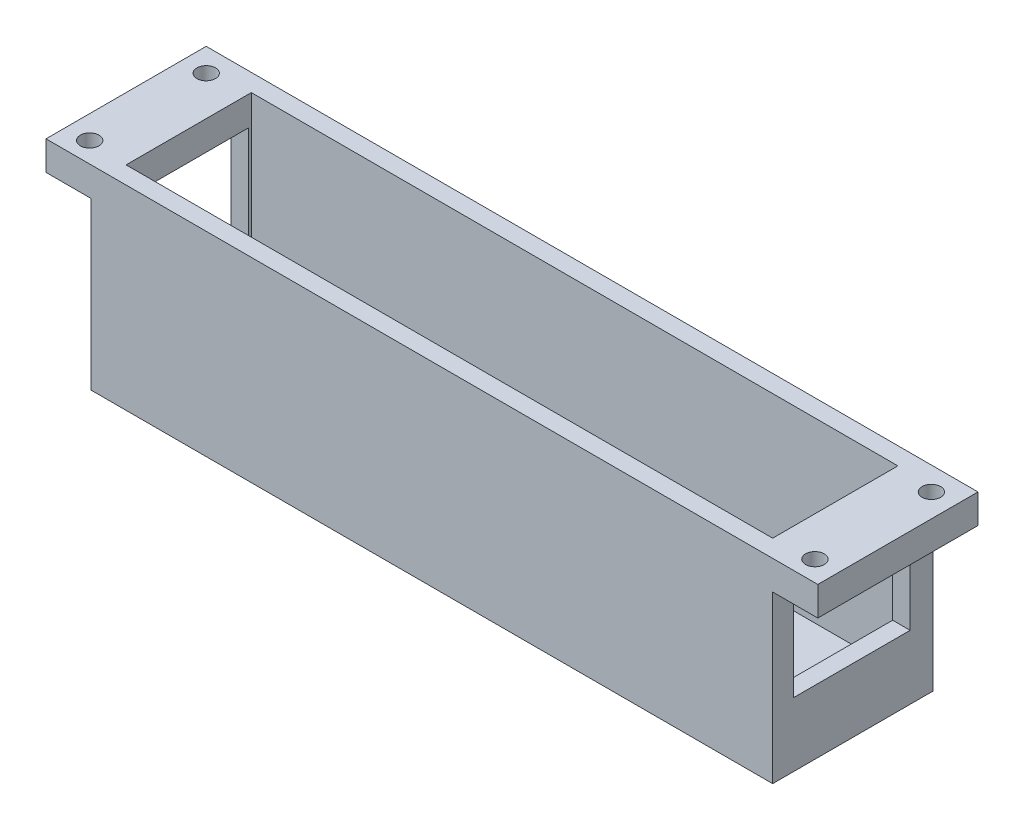
from build123d import *

# Parameters (mm, degrees)
DODANIE_WYCI_GNI_CIE1_DEPTH = 27.5
SZKIC2_W                    = 111
SZKIC2_H                    = 21.5
WYTNIJ_WYCI_GNI_CIE1_DEPTH  = 30.5
SZKIC3_W                    = 20
SZKIC3_H                    = 15
WYTNIJ_WYCI_GNI_CIE2_DEPTH  = 3
SZKIC4_W                    = 20.5
SZKIC4_H                    = 20
WYTNIJ_WYCI_GNI_CIE3_DEPTH  = 3
SZKIC5_R                    = 1.6
WYTNIJ_WYCI_GNI_CIE4_DEPTH  = 133.064614867


with BuildPart() as part:
    # Szkic1 → Dodanie-wyciągnięcie1 (new body)
    with BuildSketch(Plane.XY):
        Polygon((0, 0), (117, 0), (117, 28.5), (124.75, 28.5), (124.75, 33.5), (-7.75, 33.5), (-7.75, 28.5), (0, 28.5), align=None)
    extrude(amount=DODANIE_WYCI_GNI_CIE1_DEPTH)

    # Szkic2 → Wytnij-wyciągnięcie1 (cut)
    with BuildSketch(Plane(origin=(0, 33.5, 0), x_dir=(1, 0, 0), z_dir=(0, 1, 0))):
        with Locations((58.5, -13.75)):
            Rectangle(SZKIC2_W, SZKIC2_H)
    extrude(amount=-WYTNIJ_WYCI_GNI_CIE1_DEPTH, mode=Mode.SUBTRACT)

    # Szkic3 → Wytnij-wyciągnięcie2 (cut)
    with BuildSketch(Plane(origin=(117, 0, 0), x_dir=(0, 0, -1), z_dir=(1, 0, 0))):
        with Locations((-13.9, 18.5)):
            Rectangle(SZKIC3_W, SZKIC3_H)
    extrude(amount=-WYTNIJ_WYCI_GNI_CIE2_DEPTH, mode=Mode.SUBTRACT)

    # Szkic4 → Wytnij-wyciągnięcie3 (cut)
    with BuildSketch(Plane.ZY):
        with Locations((13.75, 18.5)):
            Rectangle(SZKIC4_W, SZKIC4_H)
    extrude(amount=-WYTNIJ_WYCI_GNI_CIE3_DEPTH, mode=Mode.SUBTRACT)

    # Szkic5 → Wytnij-wyciągnięcie4 (cut, through all)
    with BuildSketch(Plane(origin=(0, 33.5, 0), x_dir=(1, 0, 0), z_dir=(0, 1, 0))):
        with Locations(Location((-3.75, -4, 0), (0, 0, 180))):
            Circle(SZKIC5_R)
        with Locations(Location((120.75, -4, 0), (0, 0, 180))):
            Circle(SZKIC5_R)
        with Locations(Location((120.75, -24, 0), (0, 0, 180))):
            Circle(SZKIC5_R)
        with Locations(Location((-3.75, -24, 0), (0, 0, 180))):
            Circle(SZKIC5_R)
    extrude(amount=-WYTNIJ_WYCI_GNI_CIE4_DEPTH, mode=Mode.SUBTRACT)


solid = part.part
